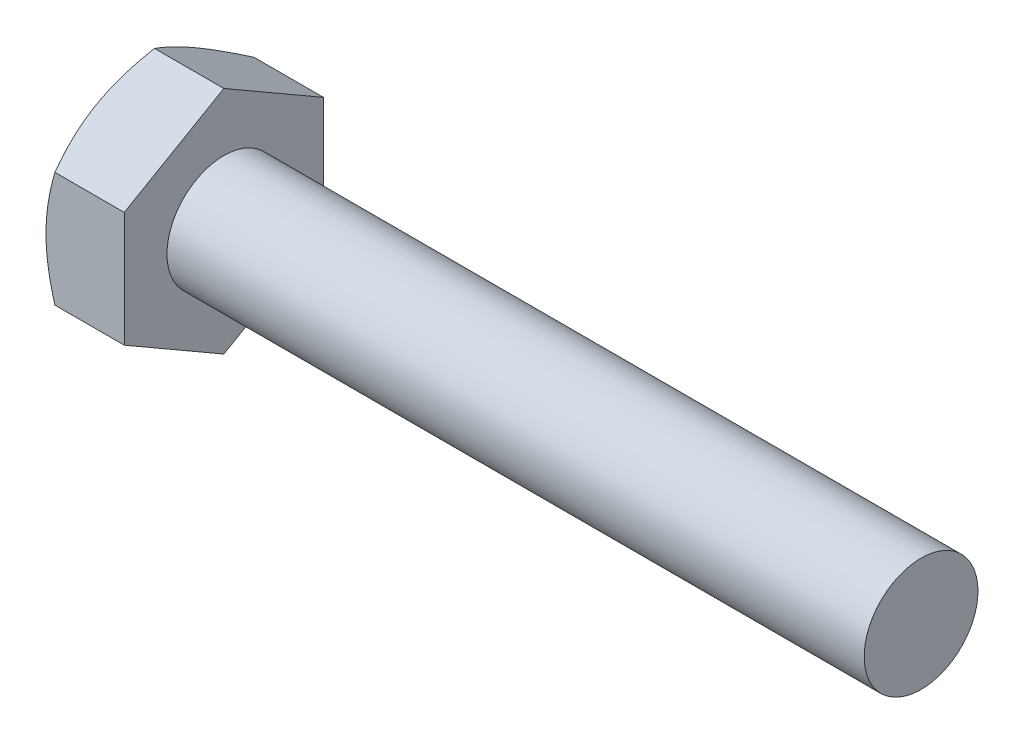
from build123d import *

# Parameters (mm, degrees)
SKETCH5_R           = 3.175
BOSS_EXTRUDE3_DEPTH = 38.89375
BOSS_EXTRUDE4_DEPTH = 4.365625
SKETCH8_OUTSIDE_W   = 178.582
SKETCH8_OUTSIDE_H   = 180.302
SKETCH8_OUTSIDE_R   = 5.55625
CUT_EXTRUDE3_DEPTH  = 45.084101347
CUT_EXTRUDE3_DRAFT  = -60


with BuildPart() as part:
    # Sketch5 → Boss-Extrude3 (new body)
    with BuildSketch(Plane(origin=(21.6296875, 0, 0), x_dir=(0, 0, -1), z_dir=(1, 0, 0))):
        Circle(SKETCH5_R)
    extrude(amount=-BOSS_EXTRUDE3_DEPTH)

    # Sketch6 → Boss-Extrude4 (add)
    with BuildSketch(Plane.ZY.offset(17.2640625)):
        Polygon((5.55625, 3.207902433), (0, 6.415804866), (-5.55625, 3.207902433), (-5.55625, -3.207902433), (0, -6.415804866), (5.55625, -3.207902433), align=None)
    extrude(amount=BOSS_EXTRUDE4_DEPTH)


with BuildPart() as cut_extrude3_tool:
    # Sketch8 outside → Cut-Extrude3 (with draft: the straight prism first)
    with BuildSketch(Plane.ZY.offset(21.6296875)):
        Rectangle(SKETCH8_OUTSIDE_W, SKETCH8_OUTSIDE_H)
        Circle(SKETCH8_OUTSIDE_R, mode=Mode.SUBTRACT)
    extrude(amount=-CUT_EXTRUDE3_DEPTH)
    # Cut-Extrude3: the draft: its side faces are tilted about the plane it starts from
    cut_extrude3_sides = [cut_extrude3_tool.faces().sort_by_distance(p)[0] for p in [
        (0.912363173, -90.151, 0),
        (0.912363173, 0, 89.291),
        (0.912363173, 90.151, 0),
        (0.912363173, 0, -89.291),
        (0.912363173, 0, -5.55625),
    ]]
    draft(cut_extrude3_sides, Plane.ZY.offset(21.6296875), CUT_EXTRUDE3_DRAFT)


with BuildPart() as part_1:
    add(part.part)

    # Cut-Extrude3: cut by cut_extrude3_tool
    add(cut_extrude3_tool.part, mode=Mode.SUBTRACT)


solid = part_1.part
